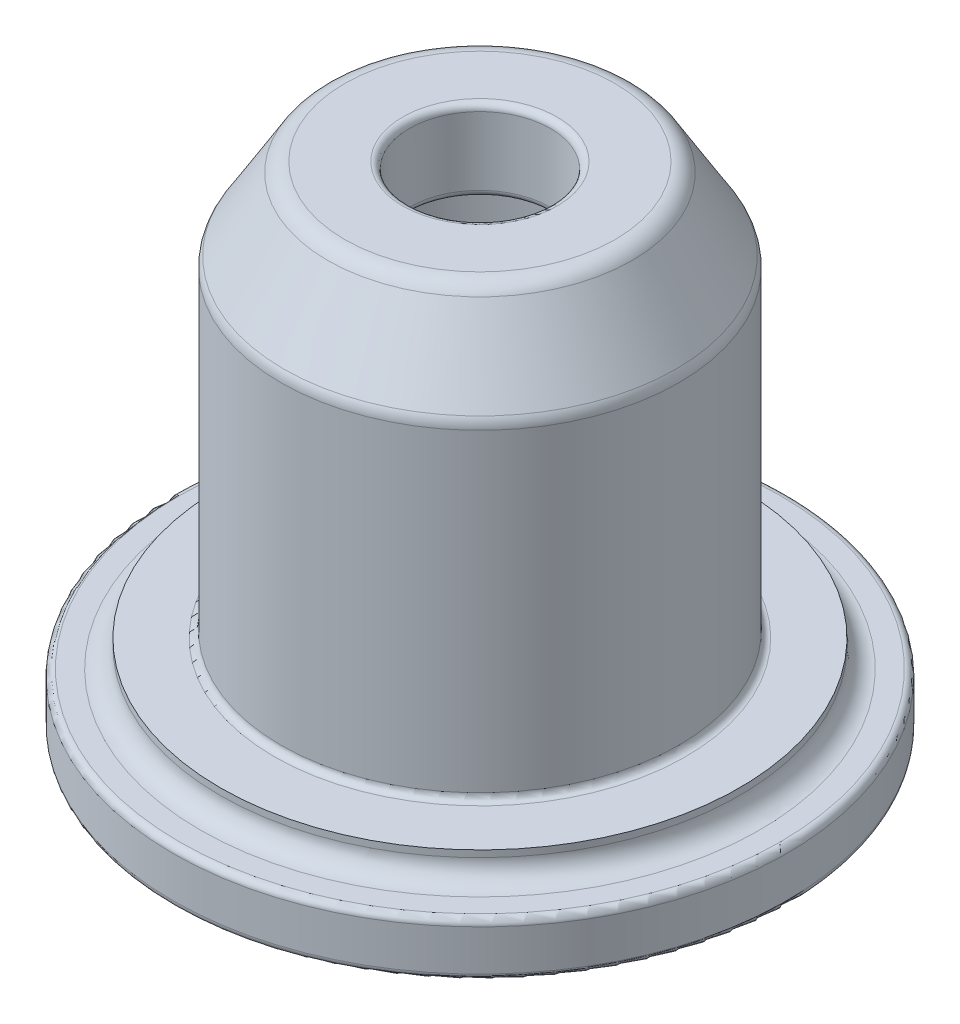
from build123d import *

# Parameters (mm, degrees)
FILLET1_R = 0.75
FILLET2_R = 0.25


with BuildPart() as part:
    # Sketch1 → Revolve1 (revolve)
    with BuildSketch(Plane.XY):
        Polygon((2.65, 19.02), (5.5, 19.02), (7.475, 15.77), (7.475, 3.52), (9.75, 3.52), (9.75, 2.52), (11.525, 2.52), (11.525, 0.52), (8, 0), (5.98, 2), (5.98, 9.5), (5.5, 9.975247525), (5.5, 15.96), (2.65, 15.96), align=None)
    revolve(axis=Axis((0, 0, 0), (0, 1, 0)))

    # Fillet1
    fillet1_edges = [part.edges().sort_by_distance(p)[0] for p in [
        (-5.5, 19.02, 0),
        (-7.475, 15.77, 0),
        (-9.75, 2.52, 0),
    ]]
    fillet(fillet1_edges, radius=FILLET1_R)

    # Fillet2
    fillet2_edges = [part.edges().sort_by_distance(p)[0] for p in [
        (-11.525, 0.52, 0),
        (-5.5, 15.96, 0),
        (-5.5, 9.975247525, 0),
        (-5.98, 9.5, 0),
        (-5.98, 2, 0),
        (-8, 0, 0),
        (-7.475, 3.52, 0),
        (-11.525, 2.52, 0),
        (-2.65, 19.02, 0),
        (-2.65, 15.96, 0),
    ]]
    fillet(fillet2_edges, radius=FILLET2_R)


solid = part.part
